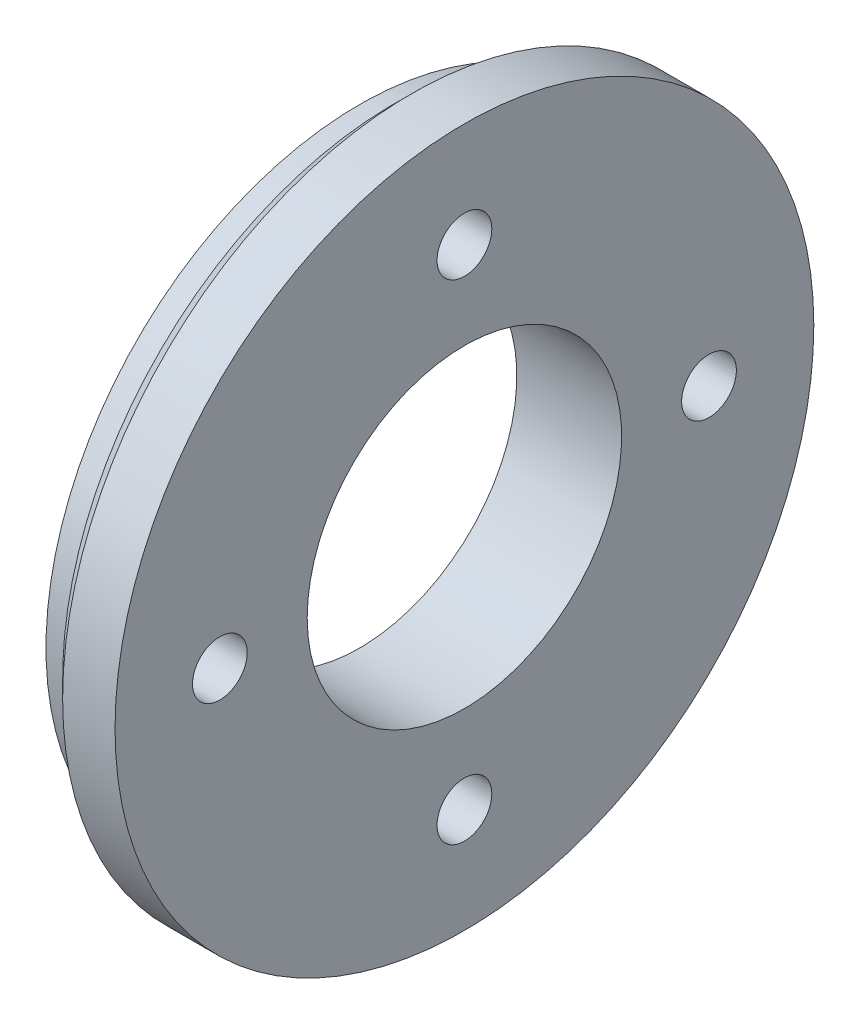
from build123d import *

# Parameters (mm, degrees)
SKETCH1_R           = 31.75
SKETCH1_R_2         = 14.2875
BOSS_EXTRUDE1_DEPTH = 4.7625
CUT_EXTRUDE1_START  = 3.175
SKETCH2_R           = 31.75
SKETCH2_R_2         = 28.4988
CUT_EXTRUDE1_DEPTH  = 3.175
SKETCH3_R           = 2.4892
CUT_EXTRUDE2_DEPTH  = 46.900442536
CHAMFER1_SIZE       = 1.5875


with BuildPart() as part:
    # Sketch1 → Boss-Extrude1 (new, symmetric)
    with BuildSketch(Plane(origin=(0, 0, 0), x_dir=(0, 0, -1), z_dir=(1, 0, 0))):
        with Locations(Location((0, 0, 0), (0, 0, 180))):
            Circle(SKETCH1_R)
        with Locations(Location((0, 0, 0), (0, 0, 180))):
            Circle(SKETCH1_R_2, mode=Mode.SUBTRACT)
    extrude(amount=BOSS_EXTRUDE1_DEPTH, both=True)

    # Sketch2 → Cut-Extrude1 (cut)
    with BuildSketch(Plane(origin=(-4.7625, 0, 0), x_dir=(0, 0, -1), z_dir=(1, 0, 0)).offset(CUT_EXTRUDE1_START)):
        with Locations(Location((0, 0, 0), (0, 0, 180))):
            Circle(SKETCH2_R)
        Circle(SKETCH2_R_2, mode=Mode.SUBTRACT)
    extrude(amount=-CUT_EXTRUDE1_DEPTH, mode=Mode.SUBTRACT)

    # Sketch3 → Cut-Extrude2 (cut, through all)
    with BuildSketch(Plane(origin=(4.7625, 0, 0), x_dir=(0, 0, -1), z_dir=(1, 0, 0))):
        with Locations((0, 22.225)):
            Circle(SKETCH3_R)
        with Locations((-22.225, 0)):
            Circle(SKETCH3_R)
        with Locations((0, -22.225)):
            Circle(SKETCH3_R)
        with Locations((22.225, 0)):
            Circle(SKETCH3_R)
    extrude(amount=-CUT_EXTRUDE2_DEPTH, mode=Mode.SUBTRACT)

    # Chamfer1
    chamfer1_edges = [part.edges().sort_by_distance(p)[0] for p in [
        (-1.5875, 0, -31.75),
    ]]
    chamfer(chamfer1_edges, length=CHAMFER1_SIZE)


solid = part.part
